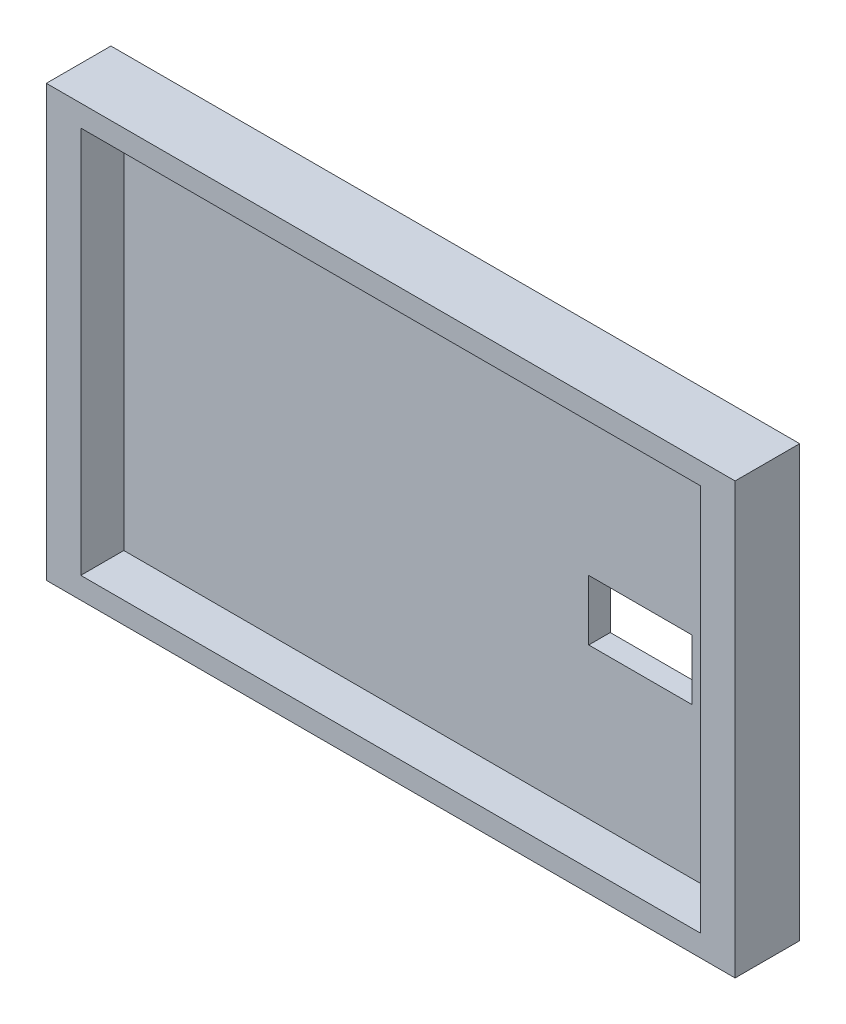
from build123d import *

# Parameters (mm, degrees)
ESQUISSE1_W                = 160
ESQUISSE1_H                = 100
ESQUISSE1_W_2              = 144
ESQUISSE1_H_2              = 90
PROFONDEUR_COUVERCLE_DEPTH = 15
ESQUISSE2_W                = 144
ESQUISSE2_H                = 90
PROFONDEUR_FOND_DEPTH      = 5
ESQUISSE3_W                = 24
ESQUISSE3_H                = 14
ECRAN_HELTEC_DEPTH         = 21


with BuildPart() as part:
    # Esquisse1 → profondeur couvercle (new body)
    with BuildSketch(Plane.XY):
        Rectangle(ESQUISSE1_W, ESQUISSE1_H)
        Rectangle(ESQUISSE1_W_2, ESQUISSE1_H_2, mode=Mode.SUBTRACT)
    extrude(amount=PROFONDEUR_COUVERCLE_DEPTH)

    # Esquisse2 → profondeur fond (add)
    with BuildSketch(Plane.XY):
        Rectangle(ESQUISSE2_W, ESQUISSE2_H)
    extrude(amount=PROFONDEUR_FOND_DEPTH)

    # Esquisse3 → ecran heltec (cut)
    with BuildSketch(Plane.XY):
        with Locations((48, -3)):
            Rectangle(ESQUISSE3_W, ESQUISSE3_H)
    extrude(amount=ECRAN_HELTEC_DEPTH, mode=Mode.SUBTRACT)


solid = part.part
